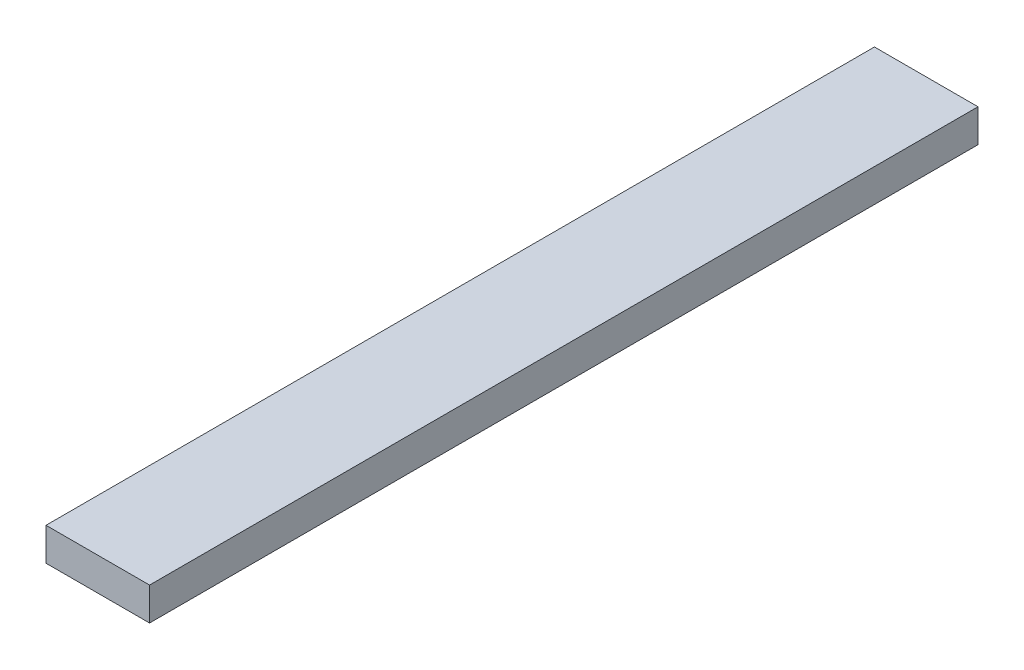
from build123d import *

# Parameters (mm, degrees)
SKETCH1_W           = 10
SKETCH1_H           = 80
BOSS_EXTRUDE1_DEPTH = 3.175


with BuildPart() as part:
    # Sketch1 → Boss-Extrude1 (new body)
    with BuildSketch(Plane(origin=(0, 0, 0), x_dir=(1, 0, 0), z_dir=(0, 1, 0))):
        Rectangle(SKETCH1_W, SKETCH1_H)
    extrude(amount=BOSS_EXTRUDE1_DEPTH)


solid = part.part
